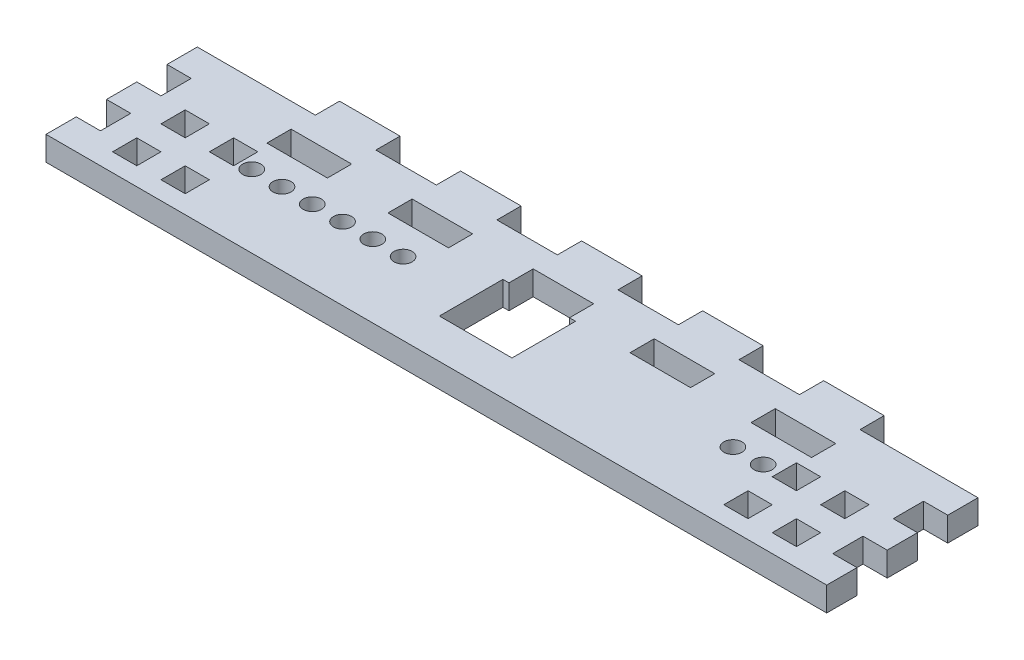
from build123d import *

# Parameters (mm, degrees)
SKETCH1_W           = 121
SKETCH1_H           = 25
BOSS_EXTRUDE1_DEPTH = 4
SKETCH2_W           = 4
SKETCH2_H           = 5
BOSS_EXTRUDE2_DEPTH = 4
LPATTERN1_COUNT     = 3
LPATTERN1_PITCH     = 10
SKETCH3_W           = 10
SKETCH3_H           = 4
BOSS_EXTRUDE3_DEPTH = 4
LPATTERN2_COUNT     = 3
LPATTERN2_PITCH     = 20
LPATTERN2_COL_COUNT = 3
LPATTERN2_COL_PITCH = 20
SKETCH4_W           = 10
SKETCH4_H           = 4
CUT_EXTRUDE1_DEPTH  = 128.538229563
SKETCH5_R           = 1.5
SKETCH5_W           = 12
SKETCH5_H           = 10.5
CUT_EXTRUDE2_DEPTH  = 128.538229563
SKETCH7_W           = 4
SKETCH7_H           = 4
CUT_EXTRUDE4_DEPTH  = 128.538229563


with BuildPart() as part:
    # Sketch1 → Boss-Extrude1 (new body)
    with BuildSketch(Plane(origin=(0, 0, 0), x_dir=(1, 0, 0), z_dir=(0, 1, 0))):
        with Locations((60.5, -12.5)):
            Rectangle(SKETCH1_W, SKETCH1_H)
    extrude(amount=BOSS_EXTRUDE1_DEPTH)

    # Sketch2 → Boss-Extrude2 (add, through all)
    with BuildSketch(Plane(origin=(0, 0, 0), x_dir=(-1, 0, 0), z_dir=(0, -1, 0))):
        with Locations((2, -22.5)):
            Rectangle(SKETCH2_W, SKETCH2_H)
        with Locations((-123, -22.5)):
            Rectangle(SKETCH2_W, SKETCH2_H)
    boss_extrude2 = extrude(amount=-BOSS_EXTRUDE2_DEPTH)

    # LPattern1: Boss-Extrude2 ×3
    with Locations(*[(0, 0, -i * LPATTERN1_PITCH) for i in range(1, LPATTERN1_COUNT)]):
        add(boss_extrude2)

    # Sketch3 → Boss-Extrude3 (add, through all)
    with BuildSketch(Plane(origin=(0, 0, 0), x_dir=(-1, 0, 0), z_dir=(0, -1, 0))):
        with Locations((-60.5, 2)):
            Rectangle(SKETCH3_W, SKETCH3_H)
    boss_extrude3 = extrude(amount=-BOSS_EXTRUDE3_DEPTH)

    # LPattern2: Boss-Extrude3 ×3
    with Locations(*[(i * LPATTERN2_PITCH, 0, 0) for i in range(1, LPATTERN2_COUNT)]):
        add(boss_extrude3)

    # LPattern2 col: Boss-Extrude3 ×3
    with Locations(*[(-i * LPATTERN2_COL_PITCH, 0, 0) for i in range(1, LPATTERN2_COL_COUNT)]):
        add(boss_extrude3)

    # Sketch4 → Cut-Extrude1 (cut, through all)
    with BuildSketch(Plane.XZ):
        with Locations((20.5, 6)):
            Rectangle(SKETCH4_W, SKETCH4_H)
        with Locations((40.5, 6)):
            Rectangle(SKETCH4_W, SKETCH4_H)
        with Locations((60.5, 6)):
            Rectangle(SKETCH4_W, SKETCH4_H)
        with Locations((80.5, 6)):
            Rectangle(SKETCH4_W, SKETCH4_H)
        with Locations((100.5, 6)):
            Rectangle(SKETCH4_W, SKETCH4_H)
    extrude(amount=-CUT_EXTRUDE1_DEPTH, mode=Mode.SUBTRACT)

    # Sketch5 → Cut-Extrude2 (cut, through all)
    with BuildSketch(Plane(origin=(0, 4, 0), x_dir=(1, 0, 0), z_dir=(0, 1, 0))):
        with Locations(Location((97.5, -13, 0), (0, 0, 270))):
            Circle(SKETCH5_R)
        with Locations(Location((102.5, -13, 0), (0, 0, 270))):
            Circle(SKETCH5_R)
        with Locations(Location((43, -13, 0), (0, 0, 270))):
            Circle(SKETCH5_R)
        with Locations(Location((38, -13, 0), (0, 0, 270))):
            Circle(SKETCH5_R)
        with Locations(Location((33, -13, 0), (0, 0, 270))):
            Circle(SKETCH5_R)
        with Locations(Location((28, -13, 0), (0, 0, 270))):
            Circle(SKETCH5_R)
        with Locations(Location((23, -13, 0), (0, 0, 270))):
            Circle(SKETCH5_R)
        with Locations(Location((18, -13, 0), (0, 0, 270))):
            Circle(SKETCH5_R)
        with Locations((60.5, -13.25)):
            Rectangle(SKETCH5_W, SKETCH5_H)
    extrude(amount=-CUT_EXTRUDE2_DEPTH, mode=Mode.SUBTRACT)

    # Sketch7 → Cut-Extrude4 (cut, through all)
    with BuildSketch(Plane.XZ):
        with Locations((6, 20)):
            Rectangle(SKETCH7_W, SKETCH7_H)
        with Locations((14, 20)):
            Rectangle(SKETCH7_W, SKETCH7_H)
        with Locations((6, 12)):
            Rectangle(SKETCH7_W, SKETCH7_H)
        with Locations((14, 12)):
            Rectangle(SKETCH7_W, SKETCH7_H)
        with Locations((107, 20)):
            Rectangle(SKETCH7_W, SKETCH7_H)
        with Locations((107, 12)):
            Rectangle(SKETCH7_W, SKETCH7_H)
        with Locations((115, 20)):
            Rectangle(SKETCH7_W, SKETCH7_H)
        with Locations((115, 12)):
            Rectangle(SKETCH7_W, SKETCH7_H)
    extrude(amount=-CUT_EXTRUDE4_DEPTH, mode=Mode.SUBTRACT)


solid = part.part
